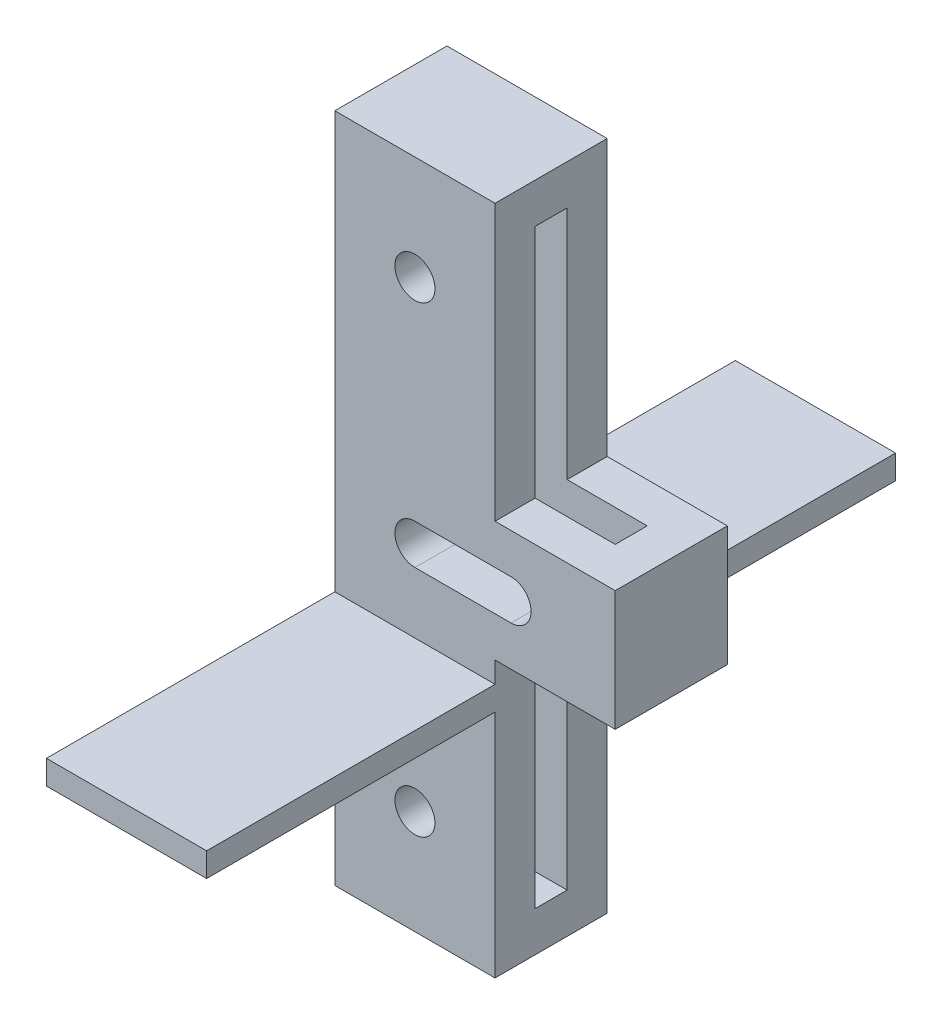
from build123d import *

# Parameters (mm, degrees)
BOSS_EXTRUDE5_DEPTH      = 10
BOSS_EXTRUDE5_DEPTH_BACK = 10
BOSS_EXTRUDE6_DEPTH      = 25
BOSS_EXTRUDE6_DEPTH_BACK = 10
SKETCH1_8_W              = 5
SKETCH1_8_H              = 15
BOSS_EXTRUDE7_START      = 20
SKETCH1_9_W              = 4
SKETCH1_9_H              = 15
BOSS_EXTRUDE7_DEPTH      = 5
BOSS_EXTRUDE8_DEPTH      = 10
BOSS_EXTRUDE8_DEPTH_BACK = 10
BOSS_EXTRUDE9_DEPTH      = 10
BOSS_EXTRUDE9_DEPTH_BACK = 10
SKETCH1_11_W             = 36
SKETCH1_11_H             = 3
CUT_EXTRUDE2_DEPTH       = 70.846371595
CUT_EXTRUDE2_DEPTH_BACK  = 70.846371595
SKETCH2_R                = 2.5


with BuildPart() as part:
    # Sketch1 → Boss-Extrude5 (new, two sides: drawn at the far end of the back side and taken through both)
    with BuildSketch(Plane(origin=(0, 0, 0), x_dir=(0, 0, -1), z_dir=(1, 0, 0)).offset(-BOSS_EXTRUDE5_DEPTH_BACK)):
        Polygon((-7, 41.875), (-7, 7.5), (-2, 7.5), (-2, 36.875), (2, 36.875), (2, 7.5), (7, 7.5), (7, 41.875), align=None)
    extrude(amount=BOSS_EXTRUDE5_DEPTH + BOSS_EXTRUDE5_DEPTH_BACK)

    # Sketch1<8> → Boss-Extrude6 (add, two sides: drawn at the far end of the back side and taken through both)
    with BuildSketch(Plane(origin=(0, 0, 0), x_dir=(0, 0, -1), z_dir=(1, 0, 0)).offset(-BOSS_EXTRUDE6_DEPTH_BACK)):
        with Locations((-4.5, 0)):
            Rectangle(SKETCH1_8_W, SKETCH1_8_H)
        with Locations((4.5, 0)):
            Rectangle(SKETCH1_8_W, SKETCH1_8_H)
    extrude(amount=BOSS_EXTRUDE6_DEPTH + BOSS_EXTRUDE6_DEPTH_BACK)

    # Sketch1<9> → Boss-Extrude7 (add)
    with BuildSketch(Plane(origin=(0, 0, 0), x_dir=(0, 0, -1), z_dir=(1, 0, 0)).offset(BOSS_EXTRUDE7_START)):
        Rectangle(SKETCH1_9_W, SKETCH1_9_H)
    extrude(amount=BOSS_EXTRUDE7_DEPTH)

    # Sketch1<10> → Boss-Extrude8 (add, two sides: drawn at the far end of the back side and taken through both)
    with BuildSketch(Plane(origin=(0, 0, 0), x_dir=(0, 0, -1), z_dir=(1, 0, 0)).offset(-BOSS_EXTRUDE8_DEPTH_BACK)):
        Polygon((-2, -7.5), (-7, -7.5), (-7, -10.125), (-7, -13.125), (-7, -41.875), (7, -41.875), (7, -13.125), (7, -10.125), (7, -7.5), (2, -7.5), (2, -36.875), (-2, -36.875), align=None)
    extrude(amount=BOSS_EXTRUDE8_DEPTH + BOSS_EXTRUDE8_DEPTH_BACK)

    # Sketch1<11> → Boss-Extrude9 (add, two sides: drawn at the far end of the back side and taken through both)
    with BuildSketch(Plane(origin=(0, 0, 0), x_dir=(0, 0, -1), z_dir=(1, 0, 0)).offset(-BOSS_EXTRUDE9_DEPTH_BACK)):
        with Locations((-25, -11.625)):
            Rectangle(SKETCH1_11_W, SKETCH1_11_H)
        with Locations((25, -11.625)):
            Rectangle(SKETCH1_11_W, SKETCH1_11_H)
    extrude(amount=BOSS_EXTRUDE9_DEPTH + BOSS_EXTRUDE9_DEPTH_BACK)

    # Sketch2 → Cut-Extrude2 (cut, two sides: drawn at the far end of the back side and taken through both)
    with BuildSketch(Plane.XY.offset(7).offset(-CUT_EXTRUDE2_DEPTH_BACK)):
        with Locations((0, 28.875)):
            Circle(SKETCH2_R)
        with Locations((0, -28.875)):
            Circle(SKETCH2_R)
        with BuildLine():
            Line((0, 2.5), (12, 2.5))
            ThreePointArc((12, 2.5), (14.5, 0), (12, -2.5))
            Line((12, -2.5), (0, -2.5))
            ThreePointArc((0, -2.5), (-2.5, 0), (0, 2.5))
        make_face()
    extrude(amount=CUT_EXTRUDE2_DEPTH + CUT_EXTRUDE2_DEPTH_BACK, mode=Mode.SUBTRACT)


solid = part.part
